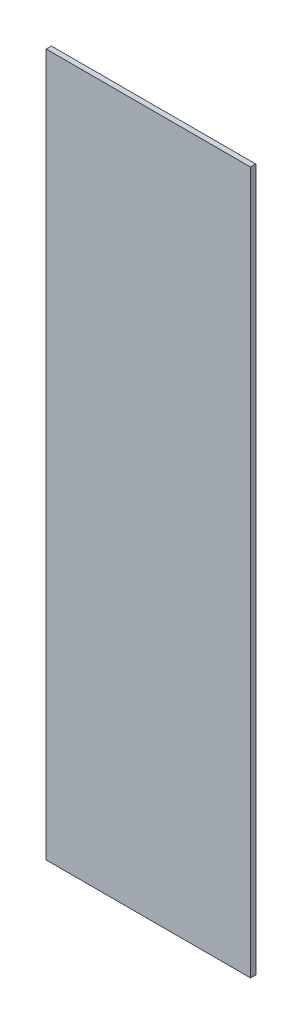
from build123d import *

# Parameters (mm, degrees)
ESQUISSE1_W        = 195
ESQUISSE1_H        = 670
BOSS_EXTRU_1_DEPTH = 5


with BuildPart() as part:
    # Esquisse1 → Boss.-Extru.1 (new body)
    with BuildSketch(Plane.XY):
        Rectangle(ESQUISSE1_W, ESQUISSE1_H)
    extrude(amount=BOSS_EXTRU_1_DEPTH)


solid = part.part
